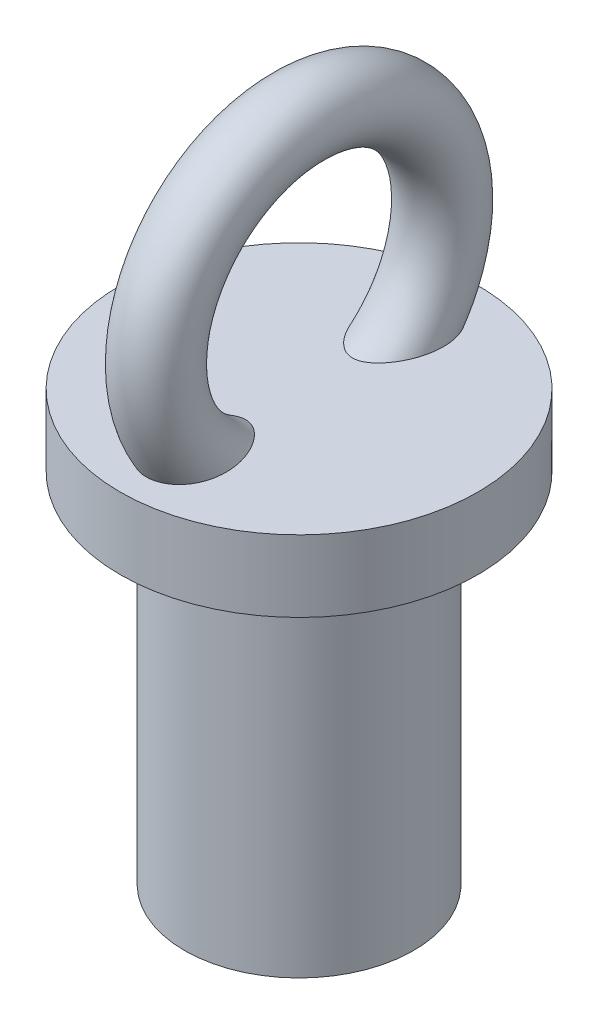
from build123d import *

# Parameters (mm, degrees)
SKETCH1_R           = 8
BOSS_EXTRUDE1_DEPTH = 25
SKETCH2_R           = 12.5
BOSS_EXTRUDE2_DEPTH = 5
SKETCH4_R           = 2.5


with BuildPart() as part:
    # Sketch1 → Boss-Extrude1 (new body)
    with BuildSketch(Plane(origin=(0, 0, 0), x_dir=(1, 0, 0), z_dir=(0, 1, 0))):
        with Locations(Location((0, 0, 0), (0, 0, 270))):
            Circle(SKETCH1_R)
    extrude(amount=BOSS_EXTRUDE1_DEPTH)

    # Sketch2 → Boss-Extrude2 (add)
    with BuildSketch(Plane(origin=(0, 25, 0), x_dir=(1, 0, 0), z_dir=(0, 1, 0))):
        with Locations(Location((0, 0, 0), (0, 0, 270))):
            Circle(SKETCH2_R)
    extrude(amount=BOSS_EXTRUDE2_DEPTH)

    # Sweep1: sweep along a path in Sketch3
    with BuildLine(Plane(origin=(0, 0, 0), x_dir=(0, 0, -1), z_dir=(1, 0, 0))) as sweep1_path:
        ThreePointArc((4.961180913, 27.822787702), (-0.153256004, 46.504163807), (-4.692751062, 27.67481802))
    # Sketch4 → Sweep1 (sweep)
    with BuildSketch(Plane.XY):
        with Locations((0, 46.505338246)):
            Circle(SKETCH4_R)
    sweep(path=sweep1_path.line)


solid = part.part
